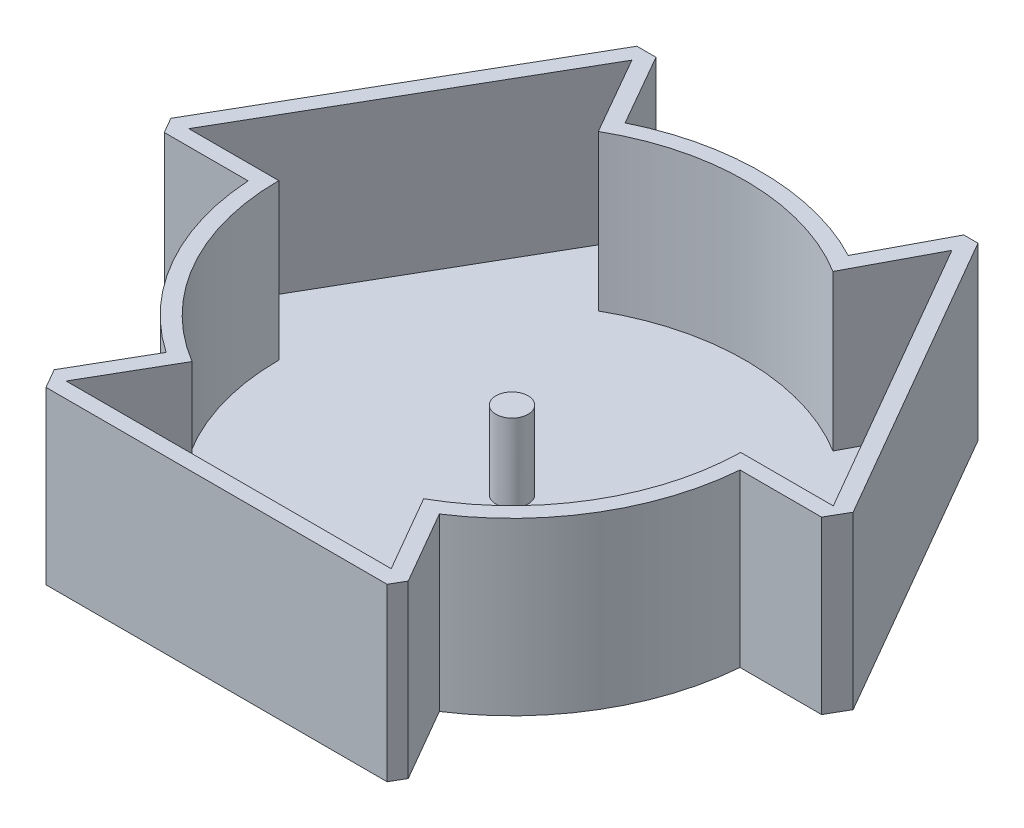
from build123d import *

# Parameters (mm, degrees)
EXTRUDE_2_DEPTH = 25.4
EXTRUDE_START   = 2.54
EXTRUDE_4_DEPTH = 2.54
SKETCH_4_R      = 2.623574207
EXTRUDE_5_DEPTH = 12.7


with BuildPart() as part:
    # 草图2 → 凸台-拉伸2 (new body)
    with BuildSketch(Plane(origin=(0, 0, 0), x_dir=(1, 0, 0), z_dir=(0, 1, 0))):
        with BuildLine():
            Line((27.862923991, 48.26), (25.533011104, 48.26))
            Line((25.533011104, 48.26), (19.005421019, 35.922187738))
            ThreePointArc((19.005421019, 35.922187738), (0.578570421, 40.635881389), (-17.97500995, 36.448712149))
            Line((-17.97500995, 36.448712149), (-24.735061671, 48.26))
            Line((-24.735061671, 48.26), (-27.862923991, 48.26))
            Line((-27.862923991, 48.26), (-55.725847982, 0))
            Line((-55.725847982, 0), (-54.259378298, -2.54))
            Line((-54.259378298, -2.54), (-40.560547334, -2.54))
            ThreePointArc((-40.560547334, -2.54), (-35.350417354, -20.048880091), (-22.997765154, -33.50690075))
            Line((-22.997765154, -33.50690075), (-28.222727801, -42.556801521))
            Line((-28.222727801, -42.556801521), (-29.689197484, -45.096801521))
            Line((-29.689197484, -45.096801521), (-27.862923991, -48.26))
            Line((-27.862923991, -48.26), (27.862923991, -48.26))
            Line((27.862923991, -48.26), (29.124677573, -46.07457869))
            Line((29.124677573, -46.07457869), (22.183228773, -34.051636689))
            ThreePointArc((22.183228773, -34.051636689), (34.920508786, -20.78864272), (40.508274586, -3.269447975))
            Line((40.508274586, -3.269447975), (53.838231313, -3.269447975))
            Line((53.838231313, -3.269447975), (55.725847982, 0))
            Line((55.725847982, 0), (27.862923991, 48.26))
        make_face()
        with BuildLine():
            Line((-26.301774892, 45.883989559), (-18.95614877, 33.049575244))
            ThreePointArc((-18.95614877, 33.049575244), (0.620872136, 38.094940842), (20.02308022, 32.414290961))
            Line((20.02308022, 32.414290961), (26.744142761, 45.117785934))
            Line((26.744142761, 45.117785934), (53.2140556, -0.729447975))
            Line((53.2140556, -0.729447975), (38.093016495, -0.729447975))
            ThreePointArc((38.093016495, -0.729447975), (32.721218848, -19.517475172), (18.742100855, -33.171428301))
            Line((18.742100855, -33.171428301), (25.987022104, -45.72))
            Line((25.987022104, -45.72), (-27.116061926, -45.72))
            Line((-27.116061926, -45.72), (-19.587157143, -32.679554389))
            ThreePointArc((-19.587157143, -32.679554389), (-33.150269133, -18.779500963), (-38.1, 0))
            Line((-38.1, 0), (-52.792908615, 0))
            Line((-52.792908615, 0), (-26.301774892, 45.883989559))
        make_face(mode=Mode.SUBTRACT)
    extrude(amount=EXTRUDE_2_DEPTH)

    # 草图3 → 凸台-拉伸4 (add)
    with BuildSketch(Plane.XZ.offset(EXTRUDE_START)):
        with BuildLine():
            Line((22.183228773, 34.051636689), (29.124677573, 46.07457869))
            Line((29.124677573, 46.07457869), (27.862923991, 48.26))
            Line((27.862923991, 48.26), (-27.862923991, 48.26))
            Line((-27.862923991, 48.26), (-29.689197484, 45.096801521))
            Line((-29.689197484, 45.096801521), (-22.997765154, 33.50690075))
            ThreePointArc((-22.997765154, 33.50690075), (-35.350417354, 20.048880091), (-40.560547334, 2.54))
            Line((-40.560547334, 2.54), (-54.259378298, 2.54))
            Line((-54.259378298, 2.54), (-55.725847982, 0))
            Line((-55.725847982, 0), (-27.862923991, -48.26))
            Line((-27.862923991, -48.26), (-24.735061671, -48.26))
            Line((-24.735061671, -48.26), (-17.97500995, -36.448712149))
            ThreePointArc((-17.97500995, -36.448712149), (0.578570421, -40.635881389), (19.005421019, -35.922187738))
            Line((19.005421019, -35.922187738), (25.533011104, -48.26))
            Line((25.533011104, -48.26), (27.862923991, -48.26))
            Line((27.862923991, -48.26), (55.725847982, 0))
            Line((55.725847982, 0), (53.838231313, 3.269447975))
            Line((53.838231313, 3.269447975), (40.508274586, 3.269447975))
            ThreePointArc((40.508274586, 3.269447975), (34.920508786, 20.78864272), (22.183228773, 34.051636689))
        make_face()
    extrude(amount=-EXTRUDE_4_DEPTH)

    # 草图4 → 凸台-拉伸5 (add)
    with BuildSketch(Plane(origin=(0, 0, 0), x_dir=(1, 0, 0), z_dir=(0, 1, 0))):
        with Locations(Location((0, 0, 0), (0, 0, 90))):
            Circle(SKETCH_4_R)
    extrude(amount=EXTRUDE_5_DEPTH)


solid = part.part
